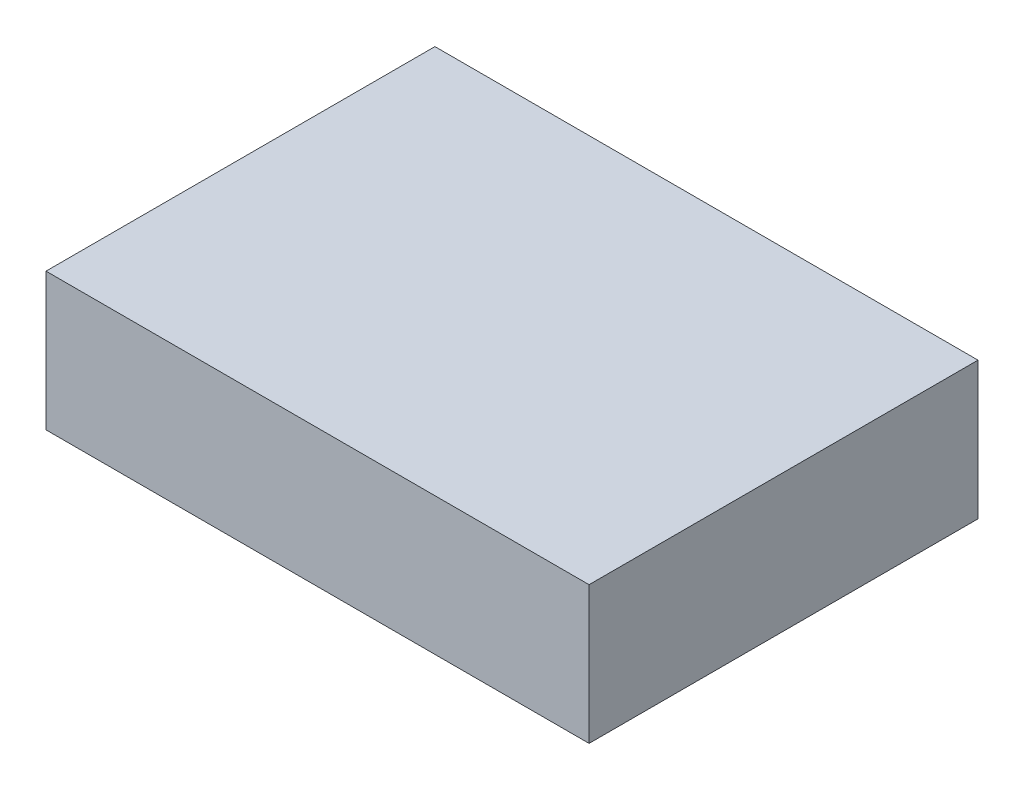
from build123d import *

# Parameters (mm, degrees)
SKETCH1_W           = 130.554298298
SKETCH1_H           = 93.497401401
BOSS_EXTRUDE1_DEPTH = 33.046022073


with BuildPart() as part:
    # Sketch1 → Boss-Extrude1 (new body)
    with BuildSketch(Plane(origin=(0, 0, 0), x_dir=(1, 0, 0), z_dir=(0, 1, 0))):
        with Locations((65.277149149, 46.748700701)):
            Rectangle(SKETCH1_W, SKETCH1_H)
    extrude(amount=BOSS_EXTRUDE1_DEPTH)


solid = part.part
